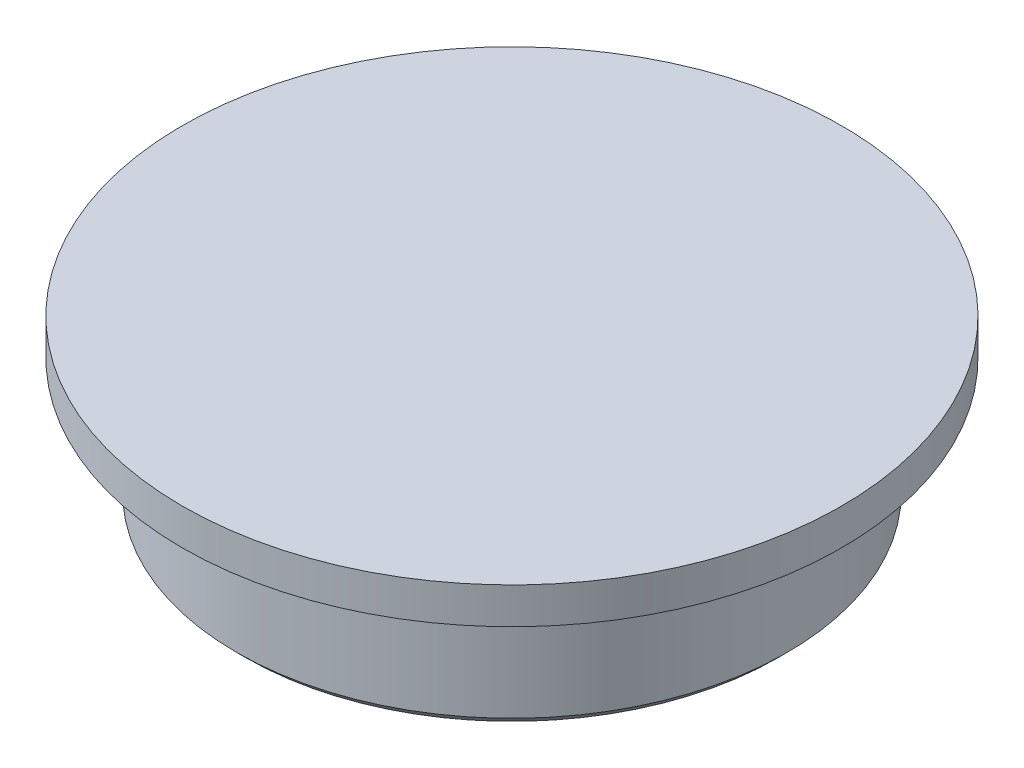
from build123d import *

# Parameters (mm, degrees)
SKETCH_1_R          = 15.2
D30_4T7_DEPTH       = 7
SKETCH_2_R          = 18.2
SKETCH_2_R_2        = 15.2
EXTRUDE_2_DEPTH     = 2
SKETCH_3_R          = 13.2
CUT_EXTRUDE_1_DEPTH = 7
CHAMFER_1_SIZE      = 0.5


with BuildPart() as part:
    # 스케치1 → D30.4t7 (new body)
    with BuildSketch(Plane(origin=(0, 0, 0), x_dir=(1, 0, 0), z_dir=(0, 1, 0))):
        with Locations(Location((0, 0, 0), (0, 0, 270))):
            Circle(SKETCH_1_R)
    extrude(amount=D30_4T7_DEPTH)

    # 스케치2 → 보스-돌출2 (add)
    # profile 1 of 3: a face of its own
    with BuildSketch(Plane(origin=(0, 7, 0), x_dir=(1, 0, 0), z_dir=(0, 1, 0))):
        with Locations(Location((0, 0, 0), (0, 0, 270))):
            Circle(SKETCH_2_R)
        with Locations(Location((0, 0, 0), (0, 0, 270))):
            Circle(SKETCH_2_R_2, mode=Mode.SUBTRACT)
    # profile 2 of 3: a face of its own
    with BuildSketch(Plane(origin=(0, 7, 0), x_dir=(1, 0, 0), z_dir=(0, 1, 0))):
        with Locations(Location((0, 0, 0), (0, 0, 270))):
            Circle(SKETCH_2_R_2)
    # profile 3 of 3: a face of its own
    with BuildSketch(Plane(origin=(0, 7, 0), x_dir=(1, 0, 0), z_dir=(0, 1, 0))):
        with Locations(Location((0, 0, 0), (0, 0, 270))):
            Circle(SKETCH_2_R_2)
    extrude(amount=EXTRUDE_2_DEPTH)

    # 스케치3 → 컷-돌출1 (cut)
    with BuildSketch(Plane.XZ):
        with Locations(Location((0, 0, 0), (0, 0, 270))):
            Circle(SKETCH_3_R)
    extrude(amount=-CUT_EXTRUDE_1_DEPTH, mode=Mode.SUBTRACT)

    # 모따기1
    chamfer_1_edges = [part.edges().sort_by_distance(p)[0] for p in [
        (0, 0, -15.2),
    ]]
    chamfer(chamfer_1_edges, length=CHAMFER_1_SIZE)


solid = part.part
